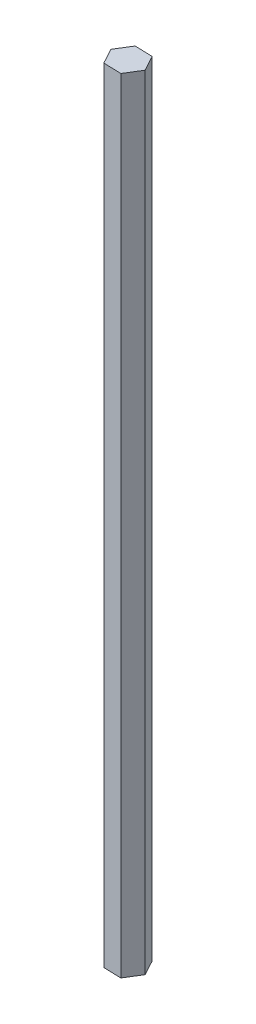
from build123d import *

# Parameters (mm, degrees)
BOSS_EXTRUDE1_DEPTH = 175


with BuildPart() as part:
    # Sketch1 → Boss-Extrude1 (new body)
    with BuildSketch(Plane(origin=(0, 0, 0), x_dir=(1, 0, 0), z_dir=(0, 1, 0))):
        Polygon((1.861307291, -3.456713541), (3.924255385, -0.116417372), (2.062948094, 3.340296169), (-1.861307291, 3.456713541), (-3.924255385, 0.116417372), (-2.062948094, -3.340296169), align=None)
    extrude(amount=BOSS_EXTRUDE1_DEPTH)


solid = part.part
